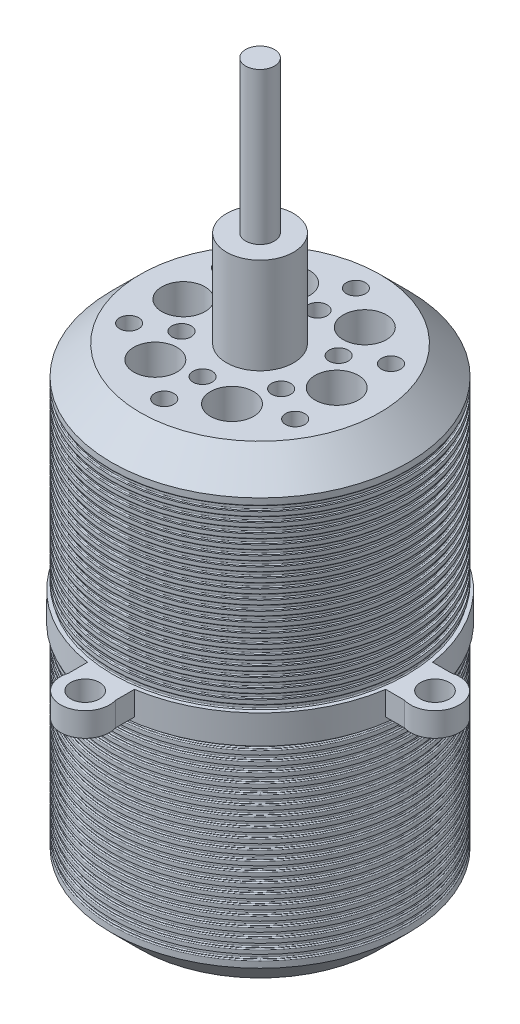
from build123d import *

# Parameters (mm, degrees)
SKETCH1_R              = 15.5
BOSS_EXTRUDE1_DEPTH    = 48.5
CHAMFER2_SIZE          = 3
SKETCH2_R              = 3.5
BOSS_EXTRUDE2_DEPTH    = 10
SKETCH3_R              = 1.5
BOSS_EXTRUDE3_DEPTH    = 15.82
SKETCH4_R              = 1.5
BOSS_EXTRUDE4_DEPTH    = 2.5
SKETCH5_R              = 1
CUT_EXTRUDE1_DEPTH     = 3
BOSS_EXTRUDE6_START    = -3
SKETCH6_R              = 15.75
SKETCH6_R_2            = 15.5
BOSS_EXTRUDE6_DEPTH    = 3
SKETCH7_R              = 2.25
CUT_EXTRUDE2_DEPTH     = 23
SKETCH8_R              = 15.738928986
SKETCH8_R_2            = 15.238928986
CUT_EXTRUDE3_DEPTH     = 0.5
FILLET1_R              = 0.1
LPATTERN1_COUNT        = 19
LPATTERN1_PITCH        = 1
FILLET1_OF_LPATTERN1_R = 0.1
CUT_EXTRUDE4_START     = 0.5
SKETCH9_R              = 15.75
SKETCH9_R_2            = 15.25
CUT_EXTRUDE4_DEPTH     = 0.5
FILLET2_R              = 0.1
LPATTERN2_COUNT        = 20
LPATTERN2_PITCH        = 1
FILLET2_OF_LPATTERN2_R = 0.1


with BuildPart() as part:
    # Sketch1 → Boss-Extrude1 (new body)
    with BuildSketch(Plane(origin=(0, 0, 0), x_dir=(1, 0, 0), z_dir=(0, 1, 0))):
        with Locations(Location((0, 0, 0), (0, 0, 90))):
            Circle(SKETCH1_R)
    extrude(amount=BOSS_EXTRUDE1_DEPTH)

    # Chamfer2
    chamfer2_edges = [part.edges().sort_by_distance(p)[0] for p in [
        (0, 0, 15.5),
        (0, 48.5, 15.5),
    ]]
    chamfer(chamfer2_edges, length=CHAMFER2_SIZE)

    # Sketch2 → Boss-Extrude2 (add)
    with BuildSketch(Plane(origin=(0, 48.5, 0), x_dir=(1, 0, 0), z_dir=(0, 1, 0))):
        with Locations(Location((0, 0, 0), (0, 0, 270))):
            Circle(SKETCH2_R)
    extrude(amount=BOSS_EXTRUDE2_DEPTH)

    # Sketch3 → Boss-Extrude3 (add)
    with BuildSketch(Plane(origin=(0, 58.5, 0), x_dir=(1, 0, 0), z_dir=(0, 1, 0))):
        with Locations(Location((0, 0, 0), (0, 0, 270))):
            Circle(SKETCH3_R)
    extrude(amount=BOSS_EXTRUDE3_DEPTH)

    # Sketch4 → Boss-Extrude4 (add)
    # profile 1 of 4: a face of its own
    with BuildSketch(Plane(origin=(0, 26.25, 0), x_dir=(1, 0, 0), z_dir=(0, 1, 0))):
        with BuildLine():
            Line((-2.446941289, 15.305635509), (-2.446941289, 17.509946108))
            ThreePointArc((-2.446941289, 17.509946108), (0, 20.806404005), (2.446941289, 17.509946108))
            Line((2.446941289, 17.509946108), (2.446941289, 15.305635509))
            Line((2.446941289, 15.305635509), (-2.446941289, 15.305635509))
        make_face()
        with Locations(Location((0, 18.25, 0), (0, 0, 270))):
            Circle(SKETCH4_R, mode=Mode.SUBTRACT)
    # profile 2 of 4: a face of its own
    with BuildSketch(Plane(origin=(0, 26.25, 0), x_dir=(1, 0, 0), z_dir=(0, 1, 0))):
        with BuildLine():
            Line((15.305635509, 2.446941289), (17.509946108, 2.446941289))
            ThreePointArc((17.509946108, 2.446941289), (20.806404005, 0), (17.509946108, -2.446941289))
            Line((17.509946108, -2.446941289), (15.305635509, -2.446941289))
            Line((15.305635509, -2.446941289), (15.305635509, 2.446941289))
        make_face()
        with Locations(Location((18.25, 0, 0), (0, 0, 270))):
            Circle(SKETCH4_R, mode=Mode.SUBTRACT)
    # profile 3 of 4: a face of its own
    with BuildSketch(Plane(origin=(0, 26.25, 0), x_dir=(1, 0, 0), z_dir=(0, 1, 0))):
        with BuildLine():
            Line((2.446941289, -15.305635509), (2.446941289, -17.509946108))
            ThreePointArc((2.446941289, -17.509946108), (0, -20.806404005), (-2.446941289, -17.509946108))
            Line((-2.446941289, -17.509946108), (-2.446941289, -15.305635509))
            Line((-2.446941289, -15.305635509), (2.446941289, -15.305635509))
        make_face()
        with Locations(Location((0, -18.25, 0), (0, 0, 270))):
            Circle(SKETCH4_R, mode=Mode.SUBTRACT)
    # profile 4 of 4: a face of its own
    with BuildSketch(Plane(origin=(0, 26.25, 0), x_dir=(1, 0, 0), z_dir=(0, 1, 0))):
        with BuildLine():
            Line((-15.305635509, -2.446941289), (-17.509946108, -2.446941289))
            ThreePointArc((-17.509946108, -2.446941289), (-20.806404005, 0), (-17.509946108, 2.446941289))
            Line((-17.509946108, 2.446941289), (-15.305635509, 2.446941289))
            Line((-15.305635509, 2.446941289), (-15.305635509, -2.446941289))
        make_face()
        with Locations(Location((-18.25, 0, 0), (0, 0, 270))):
            Circle(SKETCH4_R, mode=Mode.SUBTRACT)
    extrude(amount=-BOSS_EXTRUDE4_DEPTH)

    # Sketch5 → Cut-Extrude1 (cut)
    with BuildSketch(Plane(origin=(0, 48.5, 0), x_dir=(1, 0, 0), z_dir=(0, 1, 0))):
        with Locations(Location((0, 6, 0), (0, 0, 270))):
            Circle(SKETCH5_R)
        with Locations(Location((0, 10, 0), (0, 0, 270))):
            Circle(SKETCH5_R)
        with Locations(Location((5.196652423, 3.000866025, 0), (0, 0, 270))):
            Circle(SKETCH5_R)
        with Locations(Location((8.660754038, 5.000866025, 0), (0, 0, 270))):
            Circle(SKETCH5_R)
        with Locations(Location((5.197652423, -2.999133975, 0), (0, 0, 270))):
            Circle(SKETCH5_R)
        with Locations(Location((8.661754038, -4.999133975, 0), (0, 0, 270))):
            Circle(SKETCH5_R)
        with Locations(Location((0.002, -6, 0), (0, 0, 270))):
            Circle(SKETCH5_R)
        with Locations(Location((0.002, -10, 0), (0, 0, 270))):
            Circle(SKETCH5_R)
        with Locations(Location((-5.194652423, -3.000866025, 0), (0, 0, 270))):
            Circle(SKETCH5_R)
        with Locations(Location((-8.658754038, -5.000866025, 0), (0, 0, 270))):
            Circle(SKETCH5_R)
        with Locations(Location((-5.195652423, 2.999133975, 0), (0, 0, 270))):
            Circle(SKETCH5_R)
        with Locations(Location((-8.659754038, 4.999133975, 0), (0, 0, 270))):
            Circle(SKETCH5_R)
    extrude(amount=-CUT_EXTRUDE1_DEPTH, mode=Mode.SUBTRACT)

    # Sketch6 → Boss-Extrude6 (add)
    with BuildSketch(Plane(origin=(0, 26.25, 0), x_dir=(1, 0, 0), z_dir=(0, 1, 0)).offset(BOSS_EXTRUDE6_START)):
        with Locations(Location((0, 0, 0), (0, 0, 270))):
            Circle(SKETCH6_R)
        with Locations(Location((0, 0, 0), (0, 0, 90))):
            Circle(SKETCH6_R_2, mode=Mode.SUBTRACT)
    extrude(amount=BOSS_EXTRUDE6_DEPTH)

    # Sketch7 → Cut-Extrude2 (cut)
    with BuildSketch(Plane(origin=(0, 48.5, 0), x_dir=(1, 0, 0), z_dir=(0, 1, 0))):
        with Locations(Location((8, 0, 0), (0, 0, 270))):
            Circle(SKETCH7_R)
        with Locations(Location((4, -6.92820323, 0), (0, 0, 270))):
            Circle(SKETCH7_R)
        with Locations(Location((-4, -6.92820323, 0), (0, 0, 270))):
            Circle(SKETCH7_R)
        with Locations(Location((-8, 0, 0), (0, 0, 270))):
            Circle(SKETCH7_R)
        with Locations(Location((-4, 6.92820323, 0), (0, 0, 270))):
            Circle(SKETCH7_R)
        with Locations(Location((4, 6.92820323, 0), (0, 0, 270))):
            Circle(SKETCH7_R)
    extrude(amount=-CUT_EXTRUDE2_DEPTH, mode=Mode.SUBTRACT)

    # Sketch8 → Cut-Extrude3 (cut)
    with BuildSketch(Plane(origin=(0, 26.25, 0), x_dir=(1, 0, 0), z_dir=(0, 1, 0))):
        Circle(SKETCH8_R)
        with Locations(Location((0, 0, 0), (0, 0, 270))):
            Circle(SKETCH8_R_2, mode=Mode.SUBTRACT)
    cut_extrude3 = extrude(amount=CUT_EXTRUDE3_DEPTH, mode=Mode.SUBTRACT)

    # Fillet1
    fillet1_edges = [part.edges().sort_by_distance(p)[0] for p in [
        (0, 26.75, 15.5),
        (0, 26.25, -15.238928986),
        (0, 26.75, -15.238928986),
    ]]
    fillet(fillet1_edges, radius=FILLET1_R)

    # LPattern1: Cut-Extrude3 ×19
    with Locations(*[(0, i * LPATTERN1_PITCH, 0) for i in range(1, LPATTERN1_COUNT)]):
        add(cut_extrude3, mode=Mode.SUBTRACT)

    # Fillet1 of LPattern1
    fillet1_of_lpattern1_edges = [part.edges().sort_by_distance(p)[0] for p in [
        (0, 27.75, 15.5),
        (0, 27.25, -15.238928986),
        (0, 27.75, -15.238928986),
        (0, 28.75, 15.5),
        (0, 28.25, -15.238928986),
        (0, 28.75, -15.238928986),
        (0, 29.75, 15.5),
        (0, 29.25, -15.238928986),
        (0, 29.75, -15.238928986),
        (0, 30.75, 15.5),
        (0, 30.25, -15.238928986),
        (0, 30.75, -15.238928986),
        (0, 31.75, 15.5),
        (0, 31.25, -15.238928986),
        (0, 31.75, -15.238928986),
        (0, 32.75, 15.5),
        (0, 32.25, -15.238928986),
        (0, 32.75, -15.238928986),
        (0, 33.75, 15.5),
        (0, 33.25, -15.238928986),
        (0, 33.75, -15.238928986),
        (0, 34.75, 15.5),
        (0, 34.25, -15.238928986),
        (0, 34.75, -15.238928986),
        (0, 35.75, 15.5),
        (0, 35.25, -15.238928986),
        (0, 35.75, -15.238928986),
        (0, 36.75, 15.5),
        (0, 36.25, -15.238928986),
        (0, 36.75, -15.238928986),
        (0, 37.75, 15.5),
        (0, 37.25, -15.238928986),
        (0, 37.75, -15.238928986),
        (0, 38.75, 15.5),
        (0, 38.25, -15.238928986),
        (0, 38.75, -15.238928986),
        (0, 39.75, 15.5),
        (0, 39.25, -15.238928986),
        (0, 39.75, -15.238928986),
        (0, 40.75, 15.5),
        (0, 40.25, -15.238928986),
        (0, 40.75, -15.238928986),
        (0, 41.75, 15.5),
        (0, 41.25, -15.238928986),
        (0, 41.75, -15.238928986),
        (0, 42.75, 15.5),
        (0, 42.25, -15.238928986),
        (0, 42.75, -15.238928986),
        (0, 43.75, 15.5),
        (0, 43.25, -15.238928986),
        (0, 43.75, -15.238928986),
        (0, 44.75, 15.5),
        (0, 44.25, -15.238928986),
        (0, 44.75, -15.238928986),
    ]]
    fillet(fillet1_of_lpattern1_edges, radius=FILLET1_OF_LPATTERN1_R)

    # Sketch9 → Cut-Extrude4 (cut)
    with BuildSketch(Plane.XZ.offset(-23.25).offset(CUT_EXTRUDE4_START)):
        with Locations(Location((0, 0, 0), (0, 0, 90))):
            Circle(SKETCH9_R)
        with Locations(Location((0, 0, 0), (0, 0, 270))):
            Circle(SKETCH9_R_2, mode=Mode.SUBTRACT)
    cut_extrude4 = extrude(amount=-CUT_EXTRUDE4_DEPTH, mode=Mode.SUBTRACT)

    # Fillet2
    fillet2_edges = [part.edges().sort_by_distance(p)[0] for p in [
        (0, 22.75, 15.5),
        (0, 23.25, 15.25),
        (0, 22.75, 15.25),
    ]]
    fillet(fillet2_edges, radius=FILLET2_R)

    # LPattern2: Cut-Extrude4 ×20
    with Locations(*[(0, -i * LPATTERN2_PITCH, 0) for i in range(1, LPATTERN2_COUNT)]):
        add(cut_extrude4, mode=Mode.SUBTRACT)

    # Fillet2 of LPattern2
    fillet2_of_lpattern2_edges = [part.edges().sort_by_distance(p)[0] for p in [
        (0, 21.75, 15.5),
        (0, 22.25, 15.25),
        (0, 21.75, 15.25),
        (0, 20.75, 15.5),
        (0, 21.25, 15.25),
        (0, 20.75, 15.25),
        (0, 19.75, 15.5),
        (0, 20.25, 15.25),
        (0, 19.75, 15.25),
        (0, 18.75, 15.5),
        (0, 19.25, 15.25),
        (0, 18.75, 15.25),
        (0, 17.75, 15.5),
        (0, 18.25, 15.25),
        (0, 17.75, 15.25),
        (0, 16.75, 15.5),
        (0, 17.25, 15.25),
        (0, 16.75, 15.25),
        (0, 15.75, 15.5),
        (0, 16.25, 15.25),
        (0, 15.75, 15.25),
        (0, 14.75, 15.5),
        (0, 15.25, 15.25),
        (0, 14.75, 15.25),
        (0, 13.75, 15.5),
        (0, 14.25, 15.25),
        (0, 13.75, 15.25),
        (0, 12.75, 15.5),
        (0, 13.25, 15.25),
        (0, 12.75, 15.25),
        (0, 11.75, 15.5),
        (0, 12.25, 15.25),
        (0, 11.75, 15.25),
        (0, 10.75, 15.5),
        (0, 11.25, 15.25),
        (0, 10.75, 15.25),
        (0, 9.75, 15.5),
        (0, 10.25, 15.25),
        (0, 9.75, 15.25),
        (0, 8.75, 15.5),
        (0, 9.25, 15.25),
        (0, 8.75, 15.25),
        (0, 7.75, 15.5),
        (0, 8.25, 15.25),
        (0, 7.75, 15.25),
        (0, 6.75, 15.5),
        (0, 7.25, 15.25),
        (0, 6.75, 15.25),
        (0, 5.75, 15.5),
        (0, 6.25, 15.25),
        (0, 5.75, 15.25),
        (0, 4.75, 15.5),
        (0, 5.25, 15.25),
        (0, 4.75, 15.25),
        (0, 3.75, 15.5),
        (0, 4.25, 15.25),
        (0, 3.75, 15.25),
    ]]
    fillet(fillet2_of_lpattern2_edges, radius=FILLET2_OF_LPATTERN2_R)


solid = part.part
